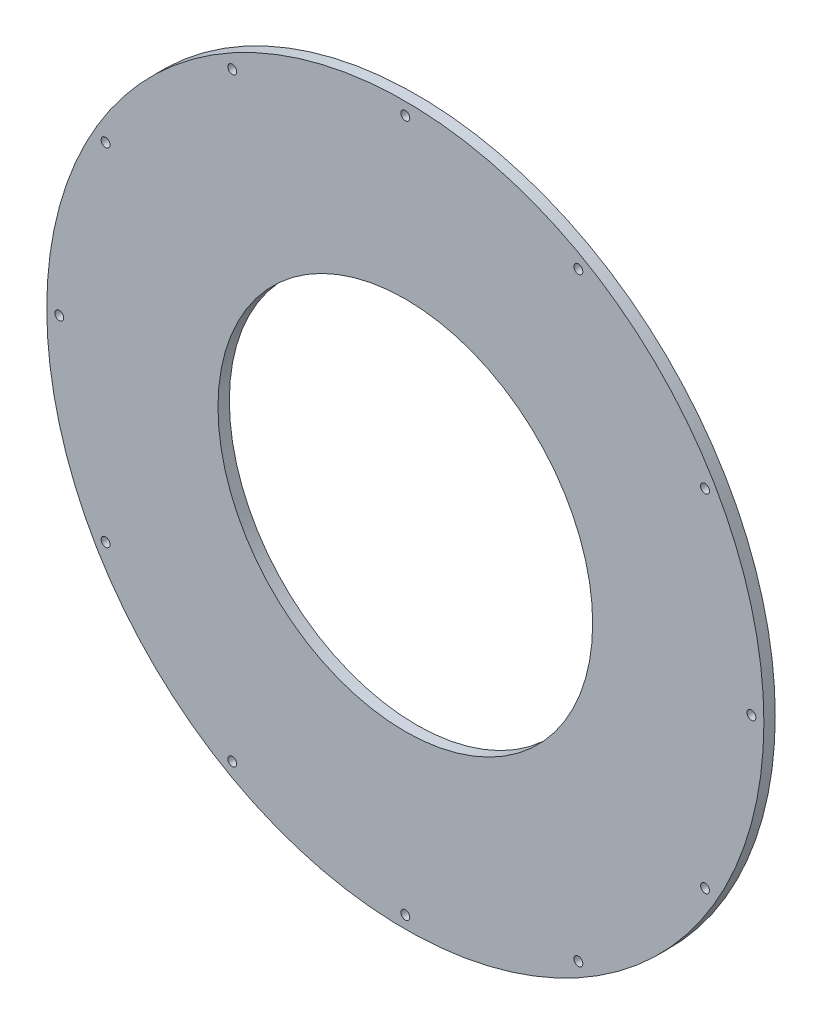
from build123d import *

# Parameters (mm, degrees)
SKETCH1_R                  = 200.533
SKETCH1_R_2                = 104.775
BOSS_EXTRUDE1_DEPTH        = 6.35
F_9_0_196_DIAMETER_HOLE1_D = 4.9784


with BuildPart() as part:
    # Sketch1 → Boss-Extrude1 (new body)
    with BuildSketch(Plane(origin=(0, 0, 0), x_dir=(0, 1, 0), z_dir=(0, 0, 1))):
        with Locations(Location((0, 0, 0), (0, 0, 270))):
            Circle(SKETCH1_R)
        with Locations(Location((0, 0, 0), (0, 0, 270))):
            Circle(SKETCH1_R_2, mode=Mode.SUBTRACT)
    extrude(amount=BOSS_EXTRUDE1_DEPTH)

    # #9 (0.196) Diameter Hole1 (through all)
    with Locations(Plane.XY.offset(6.35)):
        with Locations((-96.774, 167.617484852), (-167.617484852, 96.774), (-193.548, 0), (-167.617484852, -96.774), (-96.774, -167.617484852), (0, -193.548), (96.774, -167.617484852), (167.617484852, -96.774), (193.548, 0), (167.617484852, 96.774), (96.774, 167.617484852), (0, 193.548)):
            Hole(F_9_0_196_DIAMETER_HOLE1_D / 2)


solid = part.part
